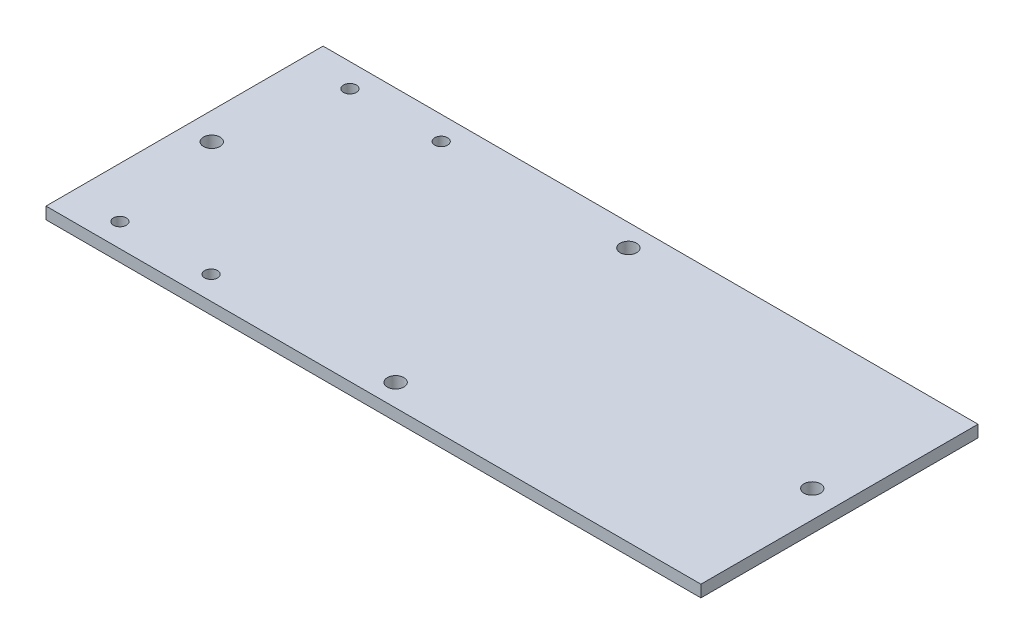
from build123d import *

# Parameters (mm, degrees)
SKETCH1_W           = 165.1
SKETCH1_H           = 69.85
BOSS_EXTRUDE1_DEPTH = 3
SKETCH3_R           = 2.0828
CUT_EXTRUDE2_DEPTH  = 5.08
SKETCH4_R           = 1.625
CUT_EXTRUDE3_DEPTH  = 17.78


with BuildPart() as part:
    # Sketch1 → Boss-Extrude1 (new body)
    with BuildSketch(Plane(origin=(0, 0, 0), x_dir=(1, 0, 0), z_dir=(0, 1, 0))):
        Rectangle(SKETCH1_W, SKETCH1_H)
    extrude(amount=BOSS_EXTRUDE1_DEPTH)

    # Sketch3 → Cut-Extrude2 (cut)
    with BuildSketch(Plane(origin=(0, 3, 0), x_dir=(1, 0, 0), z_dir=(0, 1, 0))):
        with Locations(Location((-75.692, 0, 0), (0, 0, 270))):
            Circle(SKETCH3_R)
        with Locations(Location((75.692, 0, 0), (0, 0, 270))):
            Circle(SKETCH3_R)
        with Locations(Location((0, -29.337, 0), (0, 0, 270))):
            Circle(SKETCH3_R)
        with Locations(Location((0, 29.337, 0), (0, 0, 270))):
            Circle(SKETCH3_R)
    extrude(amount=-CUT_EXTRUDE2_DEPTH, mode=Mode.SUBTRACT)

    # Sketch4 → Cut-Extrude3 (cut)
    with BuildSketch(Plane(origin=(0, 3, 0), x_dir=(1, 0, 0), z_dir=(0, 1, 0))):
        with Locations(Location((-69.85, 29, 0), (0, 0, 270))):
            Circle(SKETCH4_R)
        with Locations(Location((-46.85, 29, 0), (0, 0, 270))):
            Circle(SKETCH4_R)
        with Locations(Location((-46.85, -29, 0), (0, 0, 270))):
            Circle(SKETCH4_R)
        with Locations(Location((-69.85, -29, 0), (0, 0, 270))):
            Circle(SKETCH4_R)
    extrude(amount=-CUT_EXTRUDE3_DEPTH, mode=Mode.SUBTRACT)


solid = part.part
